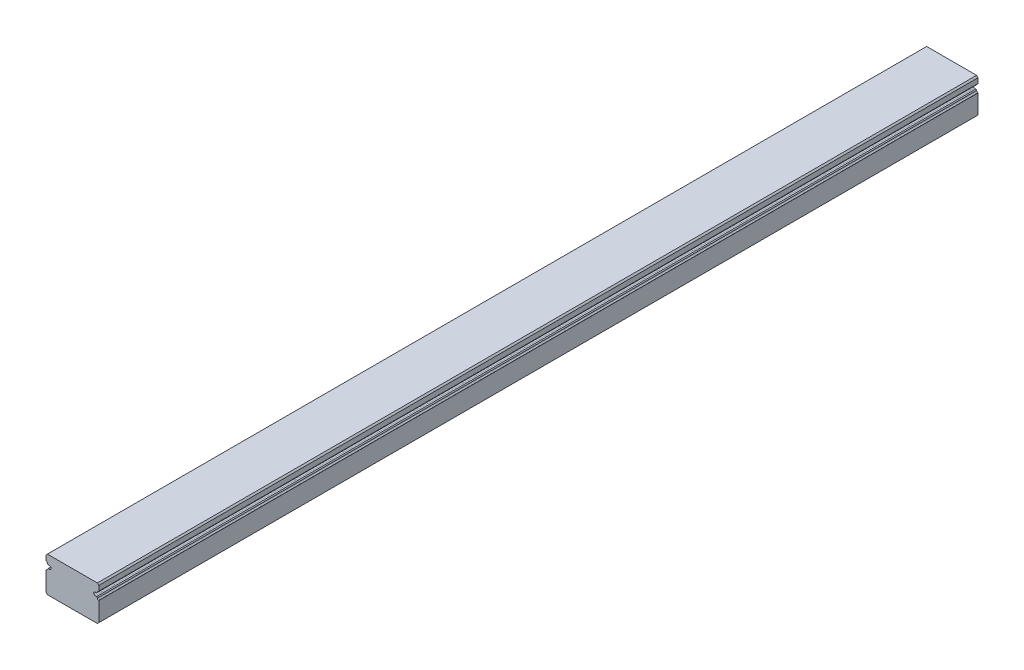
from build123d import *

# Parameters (mm, degrees)
EXTRUDE_276_DEPTH = 125


with BuildPart() as part:
    # Model → Extrude 276 (new, symmetric)
    with BuildSketch(Plane.XY):
        with BuildLine():
            Line((-7.1, -5), (7.1, -5))
            Line((7.1, -5), (7.5, -4.6))
            Line((7.5, -4.6), (7.5, 0.85))
            Line((7.5, 0.85), (7.463929973, 0.892081698))
            ThreePointArc((7.463929973, 0.892081698), (7.2158211, 1.027882975), (7.119563548, 1.293842528))
            Line((7.119563548, 1.293842528), (6.9, 1.55))
            Line((6.9, 1.55), (6.5, 1.55))
            ThreePointArc((6.5, 1.55), (6.05, 2), (6.5, 2.45))
            Line((6.5, 2.45), (6.9, 2.45))
            Line((6.9, 2.45), (7.119563548, 2.706157472))
            ThreePointArc((7.119563548, 2.706157472), (7.2158211, 2.972117025), (7.463929973, 3.107918302))
            Line((7.463929973, 3.107918302), (7.5, 3.15))
            Line((7.5, 3.15), (7.5, 4.6))
            Line((7.5, 4.6), (7.1, 5))
            Line((7.1, 5), (-7.1, 5))
            Line((-7.1, 5), (-7.5, 4.6))
            Line((-7.5, 4.6), (-7.5, 3.15))
            Line((-7.5, 3.15), (-7.463929973, 3.107918302))
            ThreePointArc((-7.463929973, 3.107918302), (-7.2158211, 2.972117025), (-7.119563548, 2.706157472))
            Line((-7.119563548, 2.706157472), (-6.9, 2.45))
            Line((-6.9, 2.45), (-6.5, 2.45))
            ThreePointArc((-6.5, 2.45), (-6.05, 2), (-6.5, 1.55))
            Line((-6.5, 1.55), (-6.9, 1.55))
            Line((-6.9, 1.55), (-7.119563548, 1.293842528))
            ThreePointArc((-7.119563548, 1.293842528), (-7.2158211, 1.027882975), (-7.463929973, 0.892081698))
            Line((-7.463929973, 0.892081698), (-7.5, 0.85))
            Line((-7.5, 0.85), (-7.5, -4.6))
            Line((-7.5, -4.6), (-7.1, -5))
        make_face()
    extrude(amount=EXTRUDE_276_DEPTH, both=True)


solid = part.part
